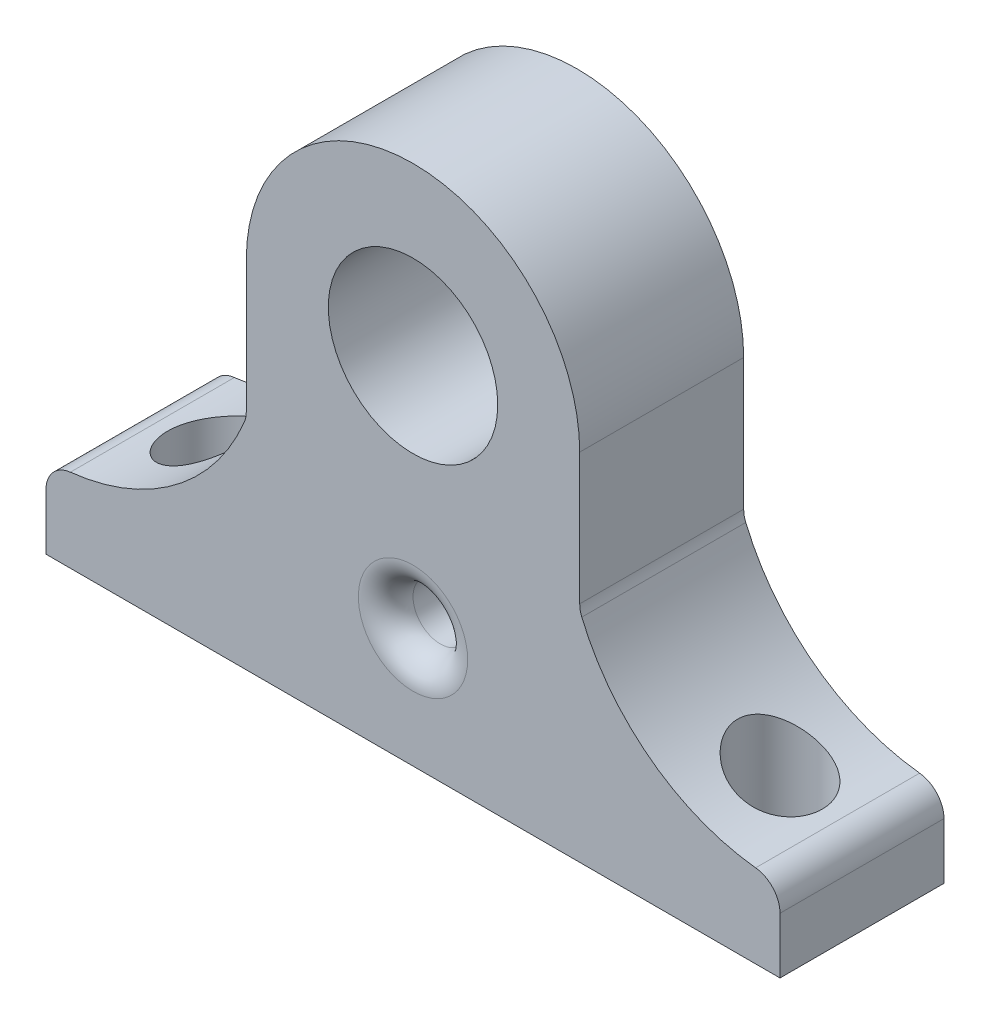
from build123d import *

# Parameters (mm, degrees)
SKETCH1_R               = 3.1
SKETCH1_R_2             = 1
BOSS_EXTRUDE1_DEPTH     = 6
CUT_EXTRUDE1_DEPTH      = 25.107196906
CUT_EXTRUDE1_DEPTH_BACK = 25.107196906
SKETCH2_R               = 1.55
FILLET1_R               = 1


with BuildPart() as part:
    # Sketch1 → Boss-Extrude1 (new body)
    with BuildSketch(Plane.XY):
        with BuildLine():
            Line((-6.1, 0), (-6.1, -4.807578818))
            ThreePointArc((-6.1, -4.807578818), (-6.119327431, -5.003234924), (-6.176562624, -5.191327971))
            ThreePointArc((-6.176562624, -5.191327971), (-9.070412736, -8.700522421), (-13.42933143, -10))
            Line((-13.42933143, -10), (-13.42933143, -13))
            Line((-13.42933143, -13), (13.42933143, -13))
            Line((13.42933143, -13), (13.42933143, -10))
            ThreePointArc((13.42933143, -10), (9.070412736, -8.700522421), (6.176562624, -5.191327971))
            ThreePointArc((6.176562624, -5.191327971), (6.119327431, -5.003234924), (6.1, -4.807578818))
            Line((6.1, -4.807578818), (6.1, 0))
            ThreePointArc((6.1, 0), (0, 6.1), (-6.1, 0))
        make_face()
        Circle(SKETCH1_R, mode=Mode.SUBTRACT)
        with Locations((0, -8.629378488)):
            Circle(SKETCH1_R_2, mode=Mode.SUBTRACT)
    extrude(amount=BOSS_EXTRUDE1_DEPTH)

    # Sketch2 → Cut-Extrude1 (cut, two sides: drawn at the far end of the back side and taken through both)
    with BuildSketch(Plane.XZ.offset(13).offset(-CUT_EXTRUDE1_DEPTH_BACK)):
        with Locations((-10.42933143, 3)):
            Circle(SKETCH2_R)
        with Locations((10.42933143, 3)):
            Circle(SKETCH2_R)
    extrude(amount=CUT_EXTRUDE1_DEPTH + CUT_EXTRUDE1_DEPTH_BACK, mode=Mode.SUBTRACT)

    # Fillet1
    fillet1_edges = [part.edges().sort_by_distance(p)[0] for p in [
        (-1, -8.629378488, 0),
        (13.42933143, -10, 3),
        (-13.42933143, -10, 3),
        (-1, -8.629378488, 6),
    ]]
    fillet(fillet1_edges, radius=FILLET1_R)


solid = part.part
